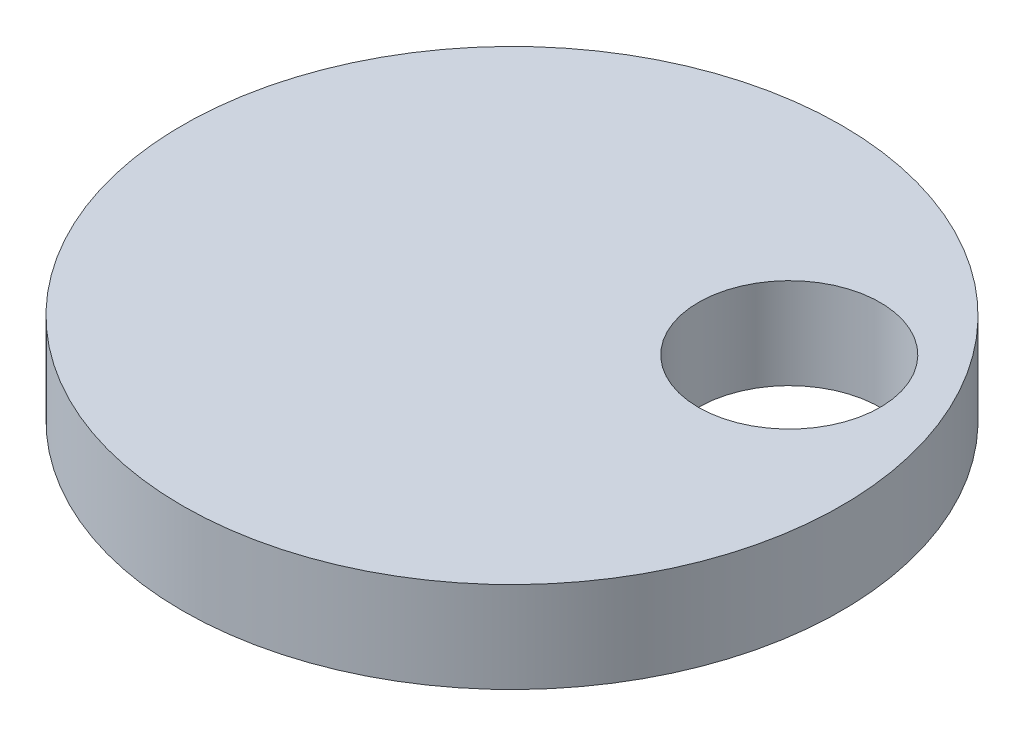
from build123d import *

# Parameters (mm, degrees)
SKETCH1_R           = 92.075
BOSS_EXTRUDE1_DEPTH = 25.4
SKETCH2_R           = 25.4
CUT_EXTRUDE1_DEPTH  = 25.4


with BuildPart() as part:
    # Sketch1 → Boss-Extrude1 (new body)
    with BuildSketch(Plane(origin=(0, 0, 0), x_dir=(1, 0, 0), z_dir=(0, 1, 0))):
        with Locations(Location((0, 0, 0), (0, 0, 270))):
            Circle(SKETCH1_R)
    extrude(amount=BOSS_EXTRUDE1_DEPTH)

    # Sketch2 → Cut-Extrude1 (cut)
    with BuildSketch(Plane(origin=(0, 25.4, 0), x_dir=(1, 0, 0), z_dir=(0, 1, 0))):
        with Locations(Location((48.26, 29.21, 0), (0, 0, 270))):
            Circle(SKETCH2_R)
    extrude(amount=-CUT_EXTRUDE1_DEPTH, mode=Mode.SUBTRACT)


solid = part.part
